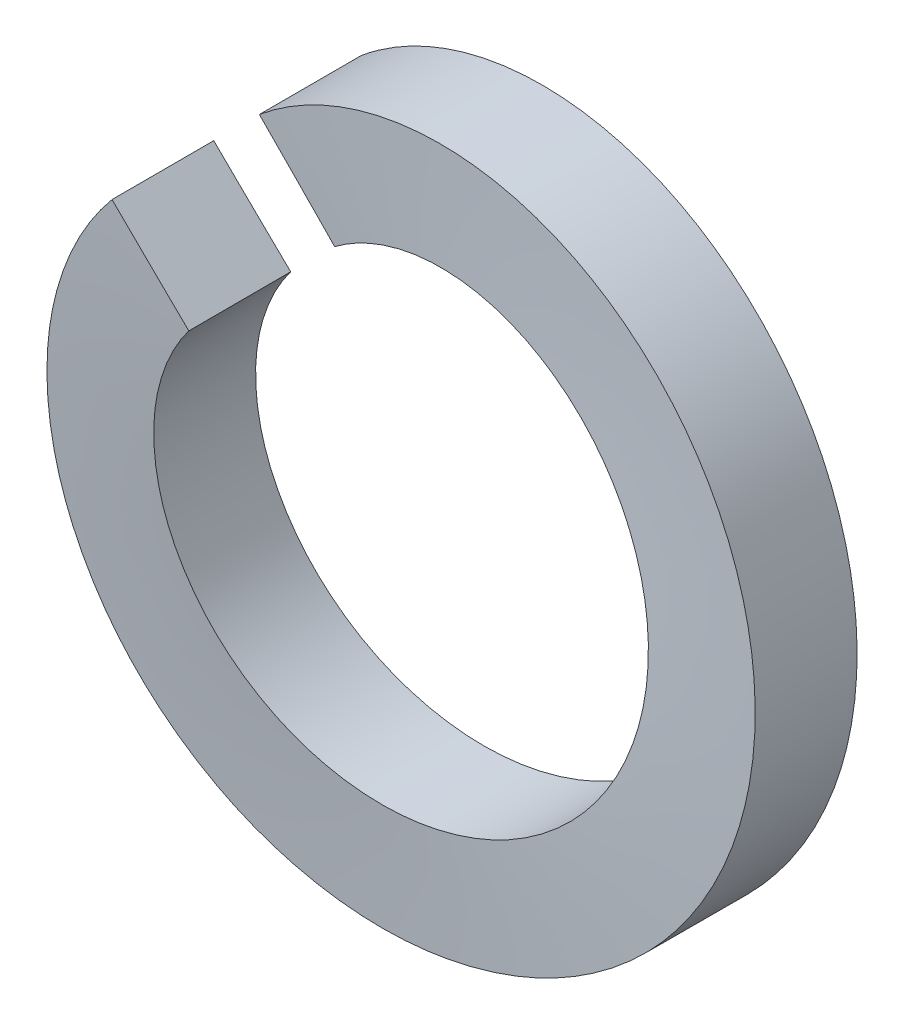
from build123d import *

# Parameters (mm, degrees)
EXTRUDE_804_DEPTH        = 0.001
EXTRUDE_804_DEPTH_BACK   = 0.001
SKETCH_6_W               = 5.66
SKETCH_6_H               = 5.96
SWEEP_3_PITCH            = 6.3
SWEEP_3_HEIGHT           = 6.3
SWEEP_3_RADIUS           = 12.25
SWEEP_3_START_ANGLE      = 135
SKETCH_7_W               = 5.7
SKETCH_7_H               = 6
CUT_EXTRUDE_1_DEPTH      = 27.575335967
CUT_EXTRUDE_1_DEPTH_BACK = 27.575335967


with BuildPart() as part:
    # 草图6 → Extrude 804 (new, two sides: drawn at the far end of the back side and taken through both)
    with BuildSketch(Plane(origin=(-8.66205807, 8.66205807, 6.3), x_dir=(0.05768456812732666, 0.057684568127325205, -0.9966669359419564), z_dir=(0.7047499489889816, 0.70474994898897, 0.08157829858529911)).offset(-EXTRUDE_804_DEPTH_BACK)):
        with Locations((2.85, 3)):
            Rectangle(SKETCH_6_W, SKETCH_6_H)
    extrude(amount=EXTRUDE_804_DEPTH + EXTRUDE_804_DEPTH_BACK)

    # 凸台-扫描3: sweep along a helix
    with BuildLine() as sweep_3_path:
        add(Helix(SWEEP_3_PITCH, SWEEP_3_HEIGHT, SWEEP_3_RADIUS, center=(0, 0, 0), direction=(0, 0, 1), lefthand=True, mode=Mode.PRIVATE).rotate(Axis((0, 0, 0), (0, 0, 1)), SWEEP_3_START_ANGLE))
    # 草图7 → 凸台-扫描3 (sweep)
    with BuildSketch(Plane(origin=(-8.66205807, 8.66205807, 6.3), x_dir=(0.05768456812732666, 0.057684568127325205, -0.9966669359419564), z_dir=(0.7047499489889816, 0.70474994898897, 0.08157829858529911))):
        with Locations((2.85, 3)):
            Rectangle(SKETCH_7_W, SKETCH_7_H)
    sweep(path=sweep_3_path.line, is_frenet=True)

    # 草图9 → 切除-拉伸1 (cut, two sides: drawn at the far end of the back side and taken through both)
    with BuildSketch(Plane.XY.offset(-CUT_EXTRUDE_1_DEPTH_BACK)):
        Polygon((-34.190291265, 36.311611608), (0.811494404, 1.30982594), (-1.30982594, -0.811494404), (-38.432931952, 36.311611608), align=None)
    extrude(amount=CUT_EXTRUDE_1_DEPTH + CUT_EXTRUDE_1_DEPTH_BACK, mode=Mode.SUBTRACT)


solid = part.part
